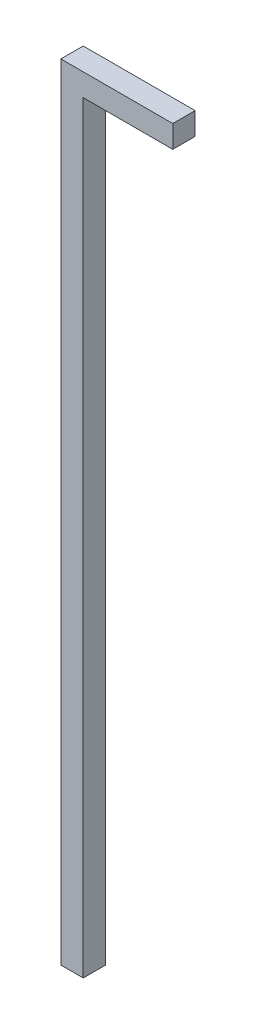
from build123d import *

# Parameters (mm, degrees)
BOSS_EXTRUDE1_DEPTH = 20


with BuildPart() as part:
    # Sketch1 → Boss-Extrude1 (new body)
    with BuildSketch(Plane.XY):
        Polygon((-183.974110429, 211.546370143), (-283.974110429, 211.546370143), (-283.974110429, -489.783629857), (-263.974110429, -489.783629857), (-263.974110429, 191.546370143), (-183.974110429, 191.546370143), align=None)
    extrude(amount=BOSS_EXTRUDE1_DEPTH)


solid = part.part
